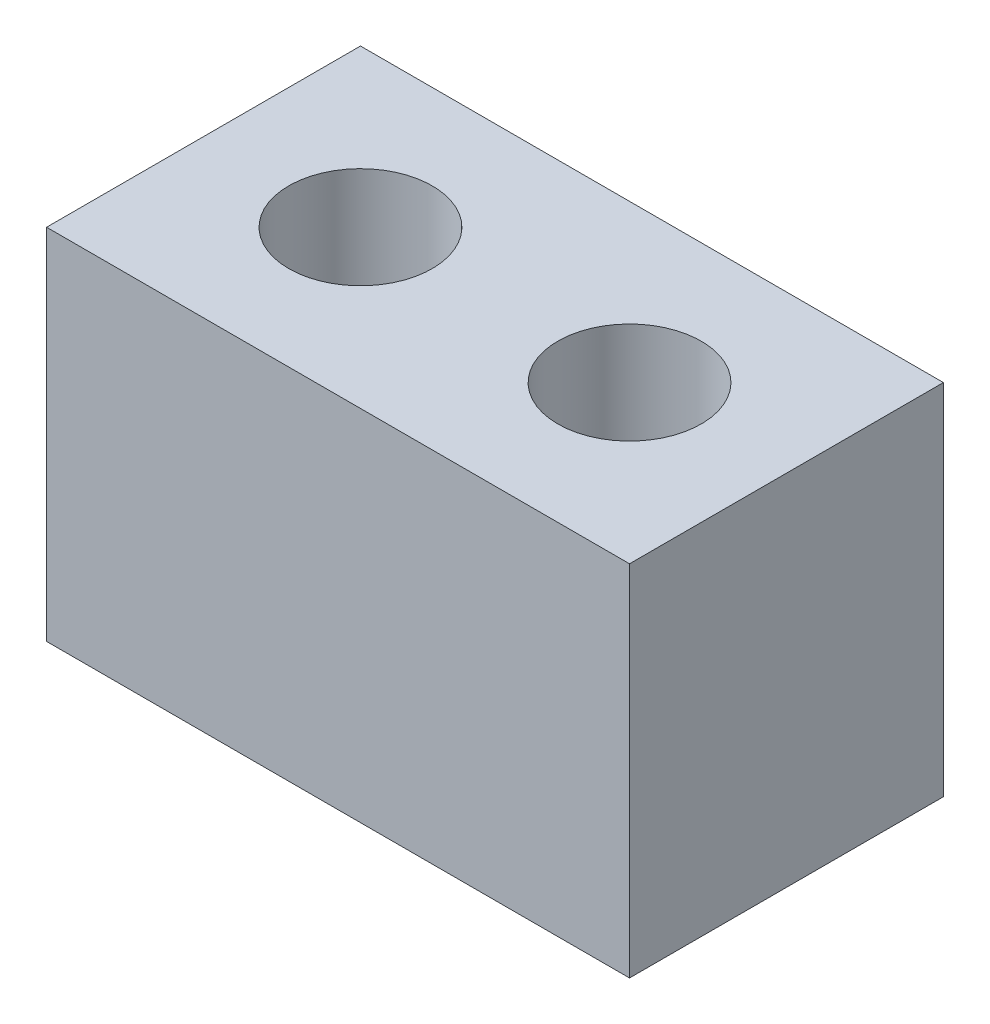
from build123d import *

# Parameters (mm, degrees)
SKETCH2_W           = 13
SKETCH2_H           = 7
SKETCH2_R           = 1.6
BOSS_EXTRUDE1_DEPTH = 8


with BuildPart() as part:
    # Sketch2 → Boss-Extrude1 (new body)
    with BuildSketch(Plane(origin=(0, 0, 0), x_dir=(1, 0, 0), z_dir=(0, 1, 0))):
        Rectangle(SKETCH2_W, SKETCH2_H)
        with Locations(Location((-3, 0, 0), (0, 0, 270))):
            Circle(SKETCH2_R, mode=Mode.SUBTRACT)
        with Locations(Location((3, 0, 0), (0, 0, 270))):
            Circle(SKETCH2_R, mode=Mode.SUBTRACT)
    extrude(amount=BOSS_EXTRUDE1_DEPTH)


solid = part.part
